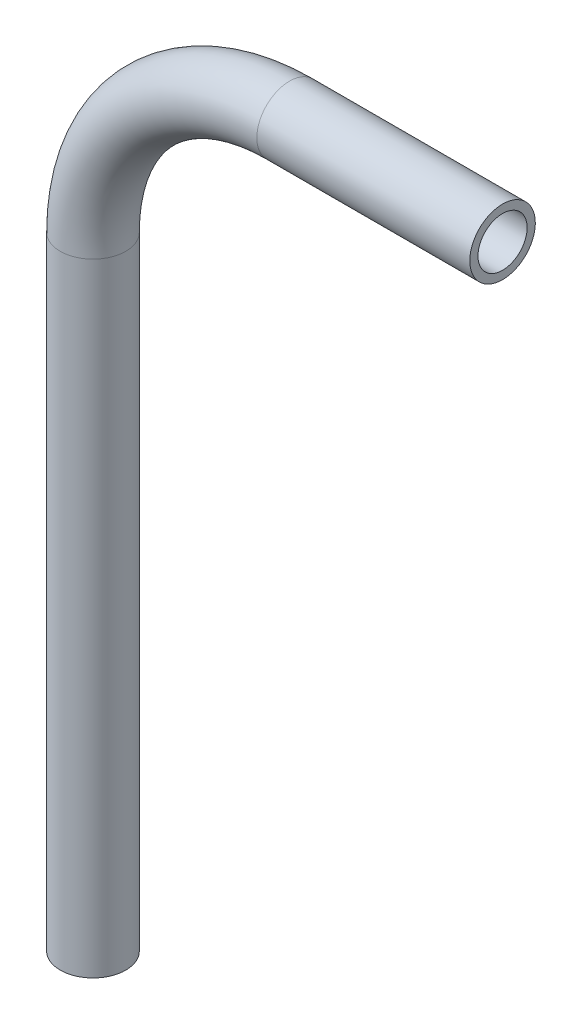
from build123d import *

# Parameters (mm, degrees)
SKETCH2_R   = 4
SKETCH2_R_2 = 3


with BuildPart() as part:
    # Sweep1: sweep along a path in Sketch1
    with BuildLine(Plane.XY) as sweep1_path:
        Line((0, 0), (0, 76))
        ThreePointArc((0, 76), (7.029437252, 92.970562748), (24, 100))
        Line((24, 100), (50, 100))
    # Sketch2 → Sweep1 (sweep)
    with BuildSketch(Plane(origin=(0, 0, 0), x_dir=(1, 0, 0), z_dir=(0, 1, 0))):
        Circle(SKETCH2_R)
        Circle(SKETCH2_R_2, mode=Mode.SUBTRACT)
    sweep(path=sweep1_path.line)


solid = part.part
